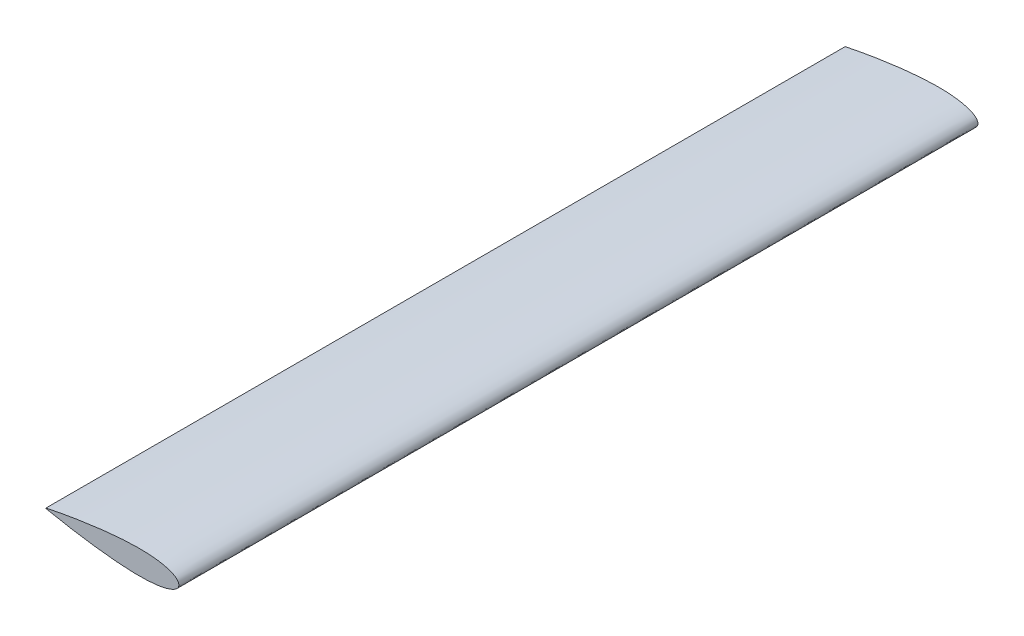
from build123d import *

# Parameters (mm, degrees)
SALIENTE_EXTRUIR1_DEPTH = 800


with BuildPart() as part:
    # Croquis7 → Saliente-Extruir1 (new, symmetric)
    with BuildSketch(Plane.XY):
        with BuildLine():
            Line((-266, -0.503), (-266, 0.503))
            add(Edge.make_bspline(
                [(-266, 0.503), (-261.568824613, 1.419104937), (-252.716442874, 3.249253805), (-234.995464143, 6.644819917), (-212.843288825, 10.548528836), (-186.239809232, 14.704279801), (-159.64065157, 18.31284697), (-133.040852362, 21.262352518), (-106.434765805, 23.353040106), (-84.236960535, 24.09624082), (-66.489266912, 23.79989373), (-53.167738863, 23.010947545), (-39.821148553, 21.488057179), (-28.71283358, 19.359904545), (-19.852958672, 16.828491563), (-13.087365413, 14.270829652), (-7.419560202, 11.192267863), (-2.207313153, 6.932106723), (1.440351568, 0), (-2.207313153, -6.932106722), (-7.419560202, -11.192267862), (-13.087365413, -14.270829652), (-19.852958672, -16.828491563), (-28.71283358, -19.359904545), (-39.821148553, -21.488057179), (-53.167738863, -23.010947545), (-66.489266912, -23.79989373), (-84.236960535, -24.09624082), (-106.434765805, -23.353040106), (-133.040852362, -21.262352518), (-159.640651569, -18.312846971), (-186.239809232, -14.704279802), (-212.843288824, -10.548528836), (-234.995464143, -6.644819918), (-252.716442874, -3.249253806), (-261.568824613, -1.419104938), (-266, -0.503)],
                knots=[0, 0, 0, 0, 0.024603893, 0.049152434, 0.098108557, 0.146905125, 0.195554767, 0.244056172, 0.292409414, 0.340643605, 0.364753981, 0.388905473, 0.413177962, 0.437756077, 0.450304615, 0.463229875, 0.477067414, 0.485035659, 0.5, 0.514964341, 0.522932586, 0.536770125, 0.549695385, 0.562243923, 0.586822038, 0.611094527, 0.635246019, 0.659356395, 0.707590586, 0.755943828, 0.804445233, 0.853094875, 0.901891443, 0.950847566, 0.975396107, 1, 1, 1, 1], degree=3))
        make_face()
    extrude(amount=SALIENTE_EXTRUIR1_DEPTH, both=True)


solid = part.part
